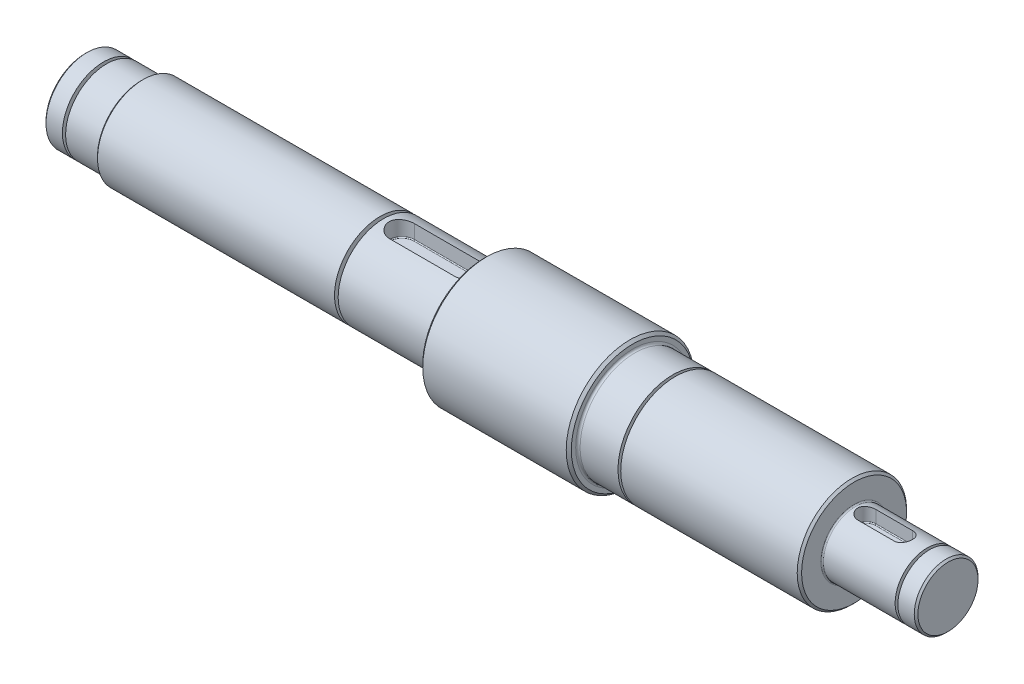
from build123d import *

# Parameters (mm, degrees)
SKETCH2_R           = 22.5
BOSS_EXTRUDE1_DEPTH = 11.75
SKETCH3_W           = 1.75
SKETCH3_H           = 4.7
CUT_EXTRUDE1_START  = 20
CUT_EXTRUDE1_DEPTH  = 20
CUT_EXTRUDE2_DEPTH  = 36
FILLET5_R           = 1
CHAMFER1_SIZE       = 1.4
CHAMFER2_SIZE       = 1.4
FILLET6_R           = 1.2
FILLET7_R           = 0.9
CHAMFER3_SIZE       = 1
CHAMFER4_SIZE       = 1.2
FILLET8_R           = 0.7
CUT_EXTRUDE3_DEPTH  = 9
CUT_EXTRUDE4_DEPTH  = 8
FILLET9_R           = 0.4
FILLET10_R          = 0.4
FILLET11_R          = 0.4
FILLET12_R          = 0.4
FILLET13_R          = 0.4
FILLET14_R          = 0.5
CHAMFER5_SIZE       = 1
CHAMFER6_SIZE       = 1


with BuildPart() as part:
    # Sketch1 → Revolve1 (revolve)
    with BuildSketch(Plane.XY, mode=Mode.PRIVATE) as revolve1_sk:
        Polygon((-215, 0), (-215, 22.5), (-196, 22.5), (-196, 25), (-65, 25), (-65, 19.9), (-63, 19.9), (-63, 25), (-8, 25), (-8, 35), (73.5, 35), (73.5, 30), (95.5, 30), (95.5, 26.5), (97, 26.5), (97, 30), (195, 30), (195, 17.5), (235, 17.5), (235, 13.6), (236.5, 13.6), (236.5, 17.5), (246.5, 17.5), (246.5, 0), (215, 0), align=None)
    revolve(revolve1_sk.sketch.rotate(Axis((-215, 0, 0), (1, 0, 0)), 90), axis=Axis((-215, 0, 0), (1, 0, 0)))

    # Sketch4 → Cut-Extrude1 (cut)
    with BuildSketch(Plane(origin=(202, 0, 0), x_dir=(0, 0, -1), z_dir=(1, 0, 0)).offset(CUT_EXTRUDE1_START)):
        with BuildLine():
            Line((-5, 9.5), (5, 9.5))
            Line((5, 9.5), (5, 16.770509831))
            ThreePointArc((5, 16.770509831), (0, 17.5), (-5, 16.770509831))
            Line((-5, 16.770509831), (-5, 9.5))
        make_face()
    extrude(amount=-CUT_EXTRUDE1_DEPTH, mode=Mode.SUBTRACT)

    # Sketch5 → Cut-Extrude2 (cut)
    with BuildSketch(Plane.ZY.offset(17)):
        with BuildLine():
            Line((-7, 16), (7, 16))
            Line((7, 16), (7, 24))
            ThreePointArc((7, 24), (0, 25), (-7, 24))
            Line((-7, 24), (-7, 16))
        make_face()
    extrude(amount=CUT_EXTRUDE2_DEPTH, mode=Mode.SUBTRACT)

    # Fillet5
    fillet5_edges = [part.edges().sort_by_distance(p)[0] for p in [
        (-8, 0, -25),
    ]]
    fillet(fillet5_edges, radius=FILLET5_R)

    # Chamfer1
    chamfer1_edges = [part.edges().sort_by_distance(p)[0] for p in [
        (-8, 0, -35),
    ]]
    chamfer(chamfer1_edges, length=CHAMFER1_SIZE)

    # Chamfer2
    chamfer2_edges = [part.edges().sort_by_distance(p)[0] for p in [
        (73.5, 0, -35),
    ]]
    chamfer(chamfer2_edges, length=CHAMFER2_SIZE)

    # Fillet6
    fillet6_edges = [part.edges().sort_by_distance(p)[0] for p in [
        (73.5, 0, -30),
    ]]
    fillet(fillet6_edges, radius=FILLET6_R)

    # Fillet7
    fillet7_edges = [part.edges().sort_by_distance(p)[0] for p in [
        (-196, 0, -22.5),
    ]]
    fillet(fillet7_edges, radius=FILLET7_R)

    # Chamfer3
    chamfer3_edges = [part.edges().sort_by_distance(p)[0] for p in [
        (-196, 0, -25),
    ]]
    chamfer(chamfer3_edges, length=CHAMFER3_SIZE)

    # Chamfer4
    chamfer4_edges = [part.edges().sort_by_distance(p)[0] for p in [
        (195, 0, -30),
    ]]
    chamfer(chamfer4_edges, length=CHAMFER4_SIZE)

    # Fillet8
    fillet8_edges = [part.edges().sort_by_distance(p)[0] for p in [
        (195, 0, -17.5),
    ]]
    fillet(fillet8_edges, radius=FILLET8_R)

    # Sketch6 → Cut-Extrude3 (cut)
    with BuildSketch(Plane(origin=(0, 25, 0), x_dir=(1, 0, 0), z_dir=(0, 1, 0))):
        with BuildLine():
            Line((-53, 7), (-53, -7))
            ThreePointArc((-53, -7), (-60, 0), (-53, 7))
        make_face()
        with BuildLine():
            Line((-17, 7), (-17, -7))
            ThreePointArc((-17, -7), (-10, 0), (-17, 7))
        make_face()
    extrude(amount=-CUT_EXTRUDE3_DEPTH, mode=Mode.SUBTRACT)

    # Sketch7 → Cut-Extrude4 (cut)
    with BuildSketch(Plane(origin=(0, 17.5, 0), x_dir=(1, 0, 0), z_dir=(0, 1, 0))):
        with BuildLine():
            Line((202, 5), (202, -5))
            ThreePointArc((202, -5), (197, 0), (202, 5))
        make_face()
        with BuildLine():
            Line((222, 5), (222, -5))
            ThreePointArc((222, -5), (227, 0), (222, 5))
        make_face()
    extrude(amount=-CUT_EXTRUDE4_DEPTH, mode=Mode.SUBTRACT)

    # Fillet9
    fillet9_edges = [part.edges().sort_by_distance(p)[0] for p in [
        (-63, 0, -19.9),
        (-65, 0, -19.9),
    ]]
    fillet(fillet9_edges, radius=FILLET9_R)

    # Fillet11
    fillet11_edges = [part.edges().sort_by_distance(p)[0] for p in [
        (97, 0, -26.5),
    ]]
    fillet(fillet11_edges, radius=FILLET11_R)

    # Fillet12
    fillet12_edges = [part.edges().sort_by_distance(p)[0] for p in [
        (95.5, 0, -26.5),
    ]]
    fillet(fillet12_edges, radius=FILLET12_R)

    # Fillet13
    fillet13_edges = [part.edges().sort_by_distance(p)[0] for p in [
        (236.5, 0, -13.6),
        (235, 0, -13.6),
    ]]
    fillet(fillet13_edges, radius=FILLET13_R)



with BuildPart() as body_2:
    # Sketch2 → Boss-Extrude1 (new body)
    with BuildSketch(Plane.ZY.offset(215)):
        Circle(SKETCH2_R)
    extrude(amount=BOSS_EXTRUDE1_DEPTH)

    # Sketch3 → Cut-Revolve1 (revolve, cut)
    with BuildSketch(Plane.XY, mode=Mode.PRIVATE) as cut_revolve1_sk:
        with Locations((-215.875, 20.15)):
            Rectangle(SKETCH3_W, SKETCH3_H)
    revolve(cut_revolve1_sk.sketch.rotate(Axis((-226.75, 0, 0), (1, 0, 0)), 90), axis=Axis((-226.75, 0, 0), (1, 0, 0)), mode=Mode.SUBTRACT)

    # Fillet10
    fillet10_edges = [body_2.edges().sort_by_distance(p)[0] for p in [
        (-216.75, 0, -17.8),
    ]]
    fillet(fillet10_edges, radius=FILLET10_R)


with BuildPart() as part_1:
    add(part.part)

    add(body_2.part)  # Revolve2 merges body 2
    # Sketch8 → Revolve2 (revolve)
    with BuildSketch(Plane.XY, mode=Mode.PRIVATE) as revolve2_sk:
        with BuildLine():
            Line((-215.4, 17.8), (-215, 17.8))
            Line((-215, 17.8), (-215, 18.2))
            ThreePointArc((-215, 18.2), (-215.117157288, 17.917157288), (-215.4, 17.8))
        make_face()
    revolve(revolve2_sk.sketch.rotate(Axis((-226.75, 0, 0), (1, 0, 0)), 270), axis=Axis((-226.75, 0, 0), (1, 0, 0)))

    # Fillet14
    fillet14_edges = [part_1.edges().sort_by_distance(p)[0] for p in [
        (212, 9.5, 5),
        (212, 9.5, -5),
        (-35, 16, -7),
        (-35, 16, 7),
        (-10, 16, 0),
        (-60, 16, 0),
        (197, 9.5, 0),
        (227, 9.5, 0),
    ]]
    fillet(fillet14_edges, radius=FILLET14_R)

    # Chamfer5
    chamfer5_edges = [part_1.edges().sort_by_distance(p)[0] for p in [
        (246.5, 0, -17.5),
    ]]
    chamfer(chamfer5_edges, length=CHAMFER5_SIZE)

    # Chamfer6
    chamfer6_edges = [part_1.edges().sort_by_distance(p)[0] for p in [
        (-226.75, 0, -22.5),
    ]]
    chamfer(chamfer6_edges, length=CHAMFER6_SIZE)


solid = part_1.part
